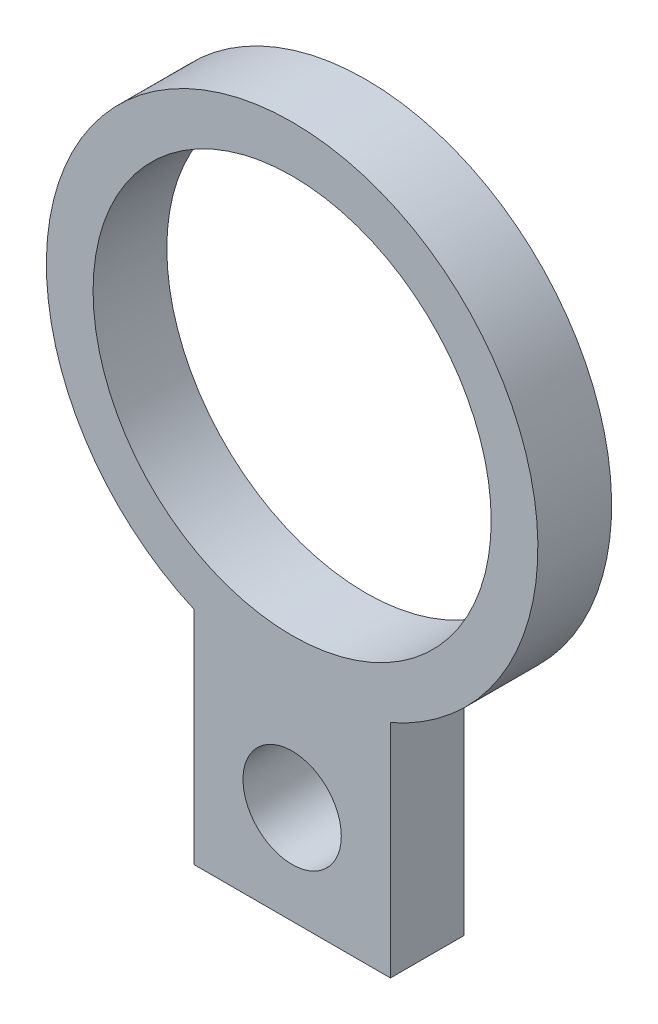
from build123d import *

# Parameters (mm, degrees)
SKETCH_1_R      = 1
SKETCH_1_R_2    = 4.05
EXTRUDE_1_DEPTH = 1.5


with BuildPart() as part:
    # 草图1 → 凸台-拉伸1 (new body)
    with BuildSketch(Plane.XY):
        with BuildLine():
            Line((-2, -9.082575695), (2, -9.082575695))
            Line((2, -9.082575695), (2, -4.582575695))
            ThreePointArc((2, -4.582575695), (0, 5), (-2, -4.582575695))
            Line((-2, -4.582575695), (-2, -9.082575695))
        make_face()
        with Locations((0, -7.082575695)):
            Circle(SKETCH_1_R, mode=Mode.SUBTRACT)
        Circle(SKETCH_1_R_2, mode=Mode.SUBTRACT)
    extrude(amount=EXTRUDE_1_DEPTH)


solid = part.part
